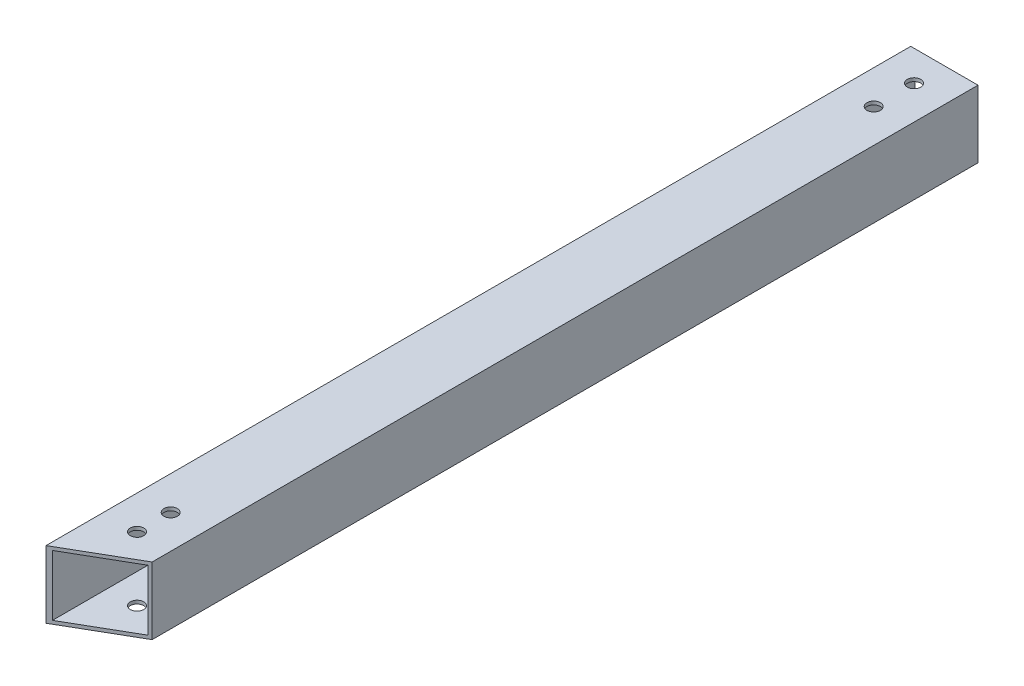
from build123d import *

# Parameters (mm, degrees)
SKETCH_1_R          = 2
EXTRUDE_1_DEPTH     = 20
SKETCH_2_W          = 18
SKETCH_2_H          = 18
CUT_EXTRUDE_1_DEPTH = 259.043348145


with BuildPart() as part:
    # 草图1 → 凸台-拉伸1 (new body)
    with BuildSketch(Plane(origin=(0, 0, 0), x_dir=(1, 0, 0), z_dir=(0, 1, 0))):
        Polygon((-10.212466243, 128.533123378), (9.787533757, 128.533123378), (9.787533757, -116.984211541), (-10.212466243, -128.531216924), align=None)
        with Locations(Location((-0.212466243, -111.466876622, 0), (0, 0, 270))):
            Circle(SKETCH_1_R, mode=Mode.SUBTRACT)
        with Locations(Location((-0.212466243, -101.466876622, 0), (0, 0, 270))):
            Circle(SKETCH_1_R, mode=Mode.SUBTRACT)
        with Locations(Location((-0.212466243, 107.533123378, 0), (0, 0, 270))):
            Circle(SKETCH_1_R, mode=Mode.SUBTRACT)
        with Locations(Location((-0.212466243, 119.533123378, 0), (0, 0, 270))):
            Circle(SKETCH_1_R, mode=Mode.SUBTRACT)
    extrude(amount=EXTRUDE_1_DEPTH)

    # 草图2 → 切除-拉伸1 (cut, through all)
    with BuildSketch(Plane(origin=(0, 0, -128.533123378), x_dir=(-1, 0, 0), z_dir=(0, 0, -1))):
        with Locations((0, 10)):
            Rectangle(SKETCH_2_W, SKETCH_2_H)
    extrude(amount=-CUT_EXTRUDE_1_DEPTH, mode=Mode.SUBTRACT)


solid = part.part
